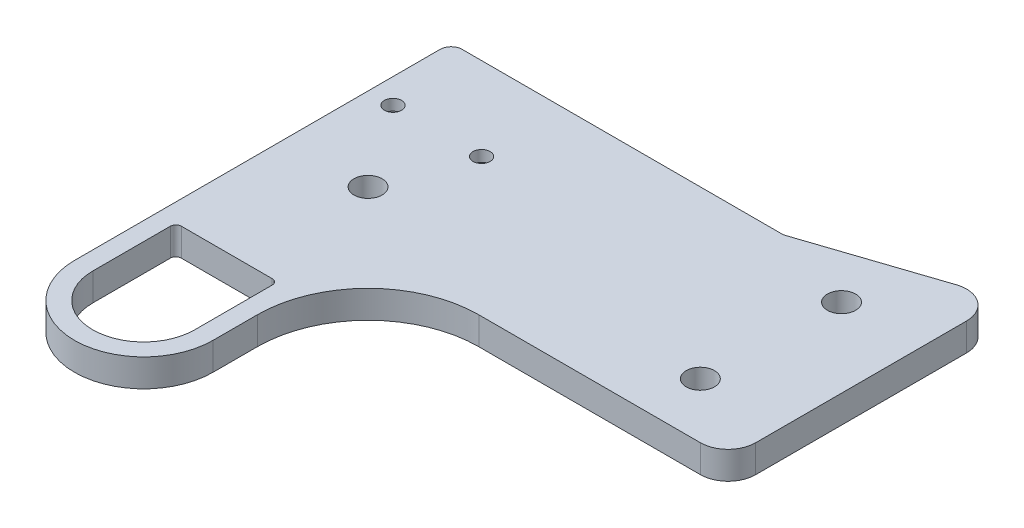
from build123d import *

# Parameters (mm, degrees)
SKETCH_1_R          = 2.55
SKETCH_1_R_2        = 7.5
EXTRUDE_1_DEPTH     = 5
FILLET_1_R          = 20
FILLET_2_R          = 5
CUT_EXTRUDE_1_DEPTH = 109.559891304
EXTRUDE_2_DEPTH     = 5
SKETCH_3_R          = 1.55
CUT_EXTRUDE_2_DEPTH = 109.559891304
FILLET_3_R          = 2
SKETCH_5_R          = 3
CUT_EXTRUDE_3_DEPTH = 3


with BuildPart() as part:
    # ｽｹｯﾁ1 → ﾎﾞｽ - 押し出し1 (new body)
    with BuildSketch(Plane(origin=(0, 0, 0), x_dir=(1, 0, 0), z_dir=(0, 1, 0))):
        with BuildLine():
            Line((0, 0), (0, -48))
            ThreePointArc((0, -48), (12.5, -60.5), (25, -48))
            Line((25, -48), (25, -20))
            Line((25, -20), (90, -20))
            Line((90, -20), (90, 30))
            Line((90, 30), (0, 0))
        make_face()
        with Locations(Location((75.769750529, 14.715657976, 0), (0, 0, 270))):
            Circle(SKETCH_1_R, mode=Mode.SUBTRACT)
        with Locations(Location((75, -10, 0), (0, 0, 270))):
            Circle(SKETCH_1_R, mode=Mode.SUBTRACT)
        with Locations(Location((15, -10, 0), (0, 0, 270))):
            Circle(SKETCH_1_R, mode=Mode.SUBTRACT)
        with Locations(Location((12.5, -48, 0), (0, 0, 270))):
            Circle(SKETCH_1_R_2, mode=Mode.SUBTRACT)
    extrude(amount=EXTRUDE_1_DEPTH)

    # ﾌｨﾚｯﾄ1
    fillet_1_edges = [part.edges().sort_by_distance(p)[0] for p in [
        (25, 2.5, 20),
    ]]
    fillet(fillet_1_edges, radius=FILLET_1_R)

    # ﾌｨﾚｯﾄ2
    fillet_2_edges = [part.edges().sort_by_distance(p)[0] for p in [
        (90, 2.5, -30),
        (90, 2.5, 20),
    ]]
    fillet(fillet_2_edges, radius=FILLET_2_R)

    # ｽｹｯﾁ2 → ｶｯﾄ - 押し出し1 (cut, through all)
    with BuildSketch(Plane(origin=(0, 5, 0), x_dir=(1, 0, 0), z_dir=(0, 1, 0))):
        with BuildLine():
            Line((3.3, -48), (3.3, -34))
            ThreePointArc((3.3, -34), (3.592893219, -33.292893219), (4.3, -33))
            Line((4.3, -33), (20.7, -33))
            ThreePointArc((20.7, -33), (21.407106781, -33.292893219), (21.7, -34))
            Line((21.7, -34), (21.7, -48))
            ThreePointArc((21.7, -48), (12.5, -57.2), (3.3, -48))
        make_face()
    extrude(amount=-CUT_EXTRUDE_1_DEPTH, mode=Mode.SUBTRACT)

    # ｽｹｯﾁ4 → ﾎﾞｽ - 押し出し2 (add)
    with BuildSketch(Plane(origin=(0, 5, 0), x_dir=(1, 0, 0), z_dir=(0, 1, 0))):
        Polygon((0, 0), (0, 20), (60, 20), align=None)
    extrude(amount=-EXTRUDE_2_DEPTH)

    # ｽｹｯﾁ3 → ｶｯﾄ - 押し出し2 (cut, through all)
    with BuildSketch(Plane(origin=(0, 5, 0), x_dir=(1, 0, 0), z_dir=(0, 1, 0))):
        with Locations(Location((20.5, 5, 0), (0, 0, 270))):
            Circle(SKETCH_3_R)
        with Locations(Location((4.5, 5, 0), (0, 0, 90))):
            Circle(SKETCH_3_R)
    extrude(amount=-CUT_EXTRUDE_2_DEPTH, mode=Mode.SUBTRACT)

    # ﾌｨﾚｯﾄ3
    fillet_3_edges = [part.edges().sort_by_distance(p)[0] for p in [
        (60, 2.5, -20),
        (0, 2.5, -20),
    ]]
    fillet(fillet_3_edges, radius=FILLET_3_R)

    # ｽｹｯﾁ5 → ｶｯﾄ - 押し出し3 (cut)
    with BuildSketch(Plane.XZ):
        with Locations(Location((4.5, -5, 0), (0, 0, 270))):
            Circle(SKETCH_5_R)
        with Locations(Location((20.5, -5, 0), (0, 0, 270))):
            Circle(SKETCH_5_R)
    extrude(amount=-CUT_EXTRUDE_3_DEPTH, mode=Mode.SUBTRACT)


solid = part.part
